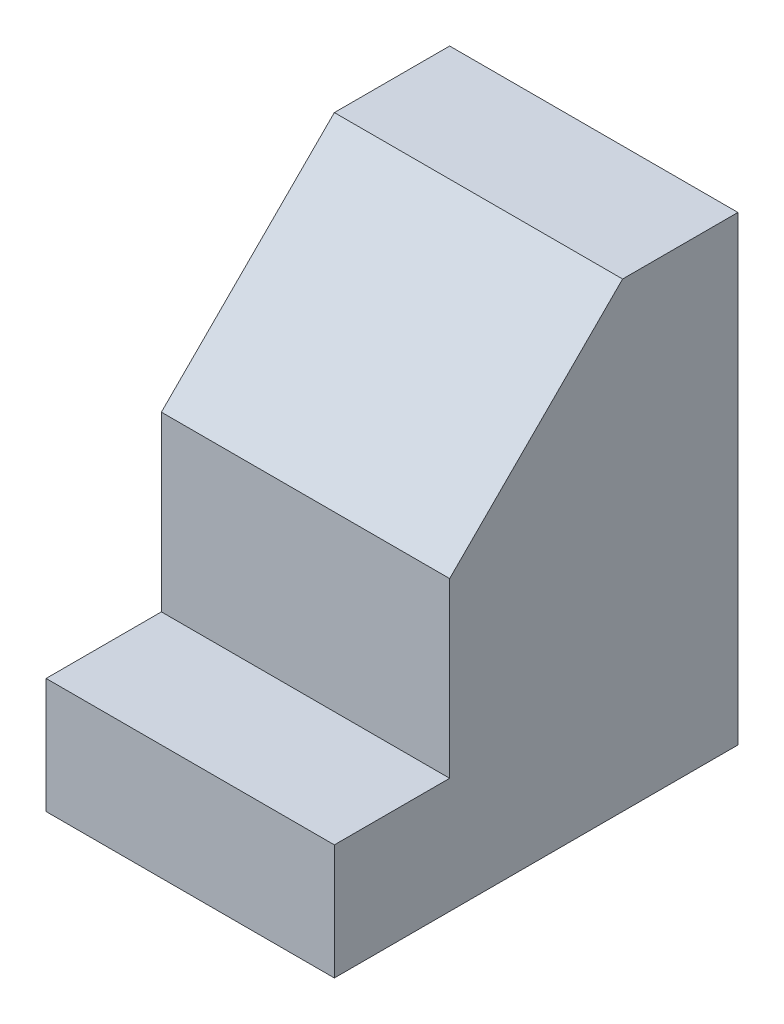
from build123d import *

# Parameters (mm, degrees)
BOSS_EXTRUDE1_DEPTH = 25000
CHAMFER2_SIZE       = 15000


with BuildPart() as part:
    # Sketch2 → Boss-Extrude1 (new body)
    with BuildSketch(Plane(origin=(0, 0, 0), x_dir=(0, 0, -1), z_dir=(1, 0, 0))):
        Polygon((0, 0), (0, 10000), (10000, 10000), (10000, 40000), (35000, 40000), (35000, 0), align=None)
    extrude(amount=-BOSS_EXTRUDE1_DEPTH)

    # Chamfer2
    chamfer2_edges = [part.edges().sort_by_distance(p)[0] for p in [
        (-12500, 40000, -10000),
    ]]
    chamfer(chamfer2_edges, length=CHAMFER2_SIZE)


solid = part.part
